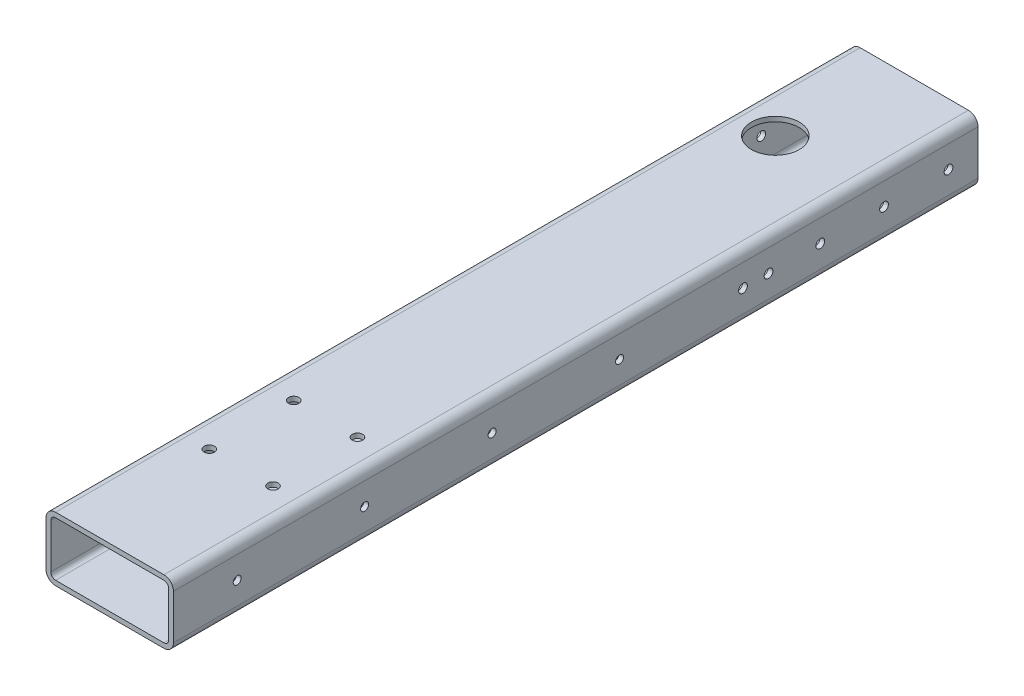
from build123d import *

# Parameters (mm, degrees)
AUFSATZ_LINEAR_AUSTRAGEN1_DEPTH = 505
SKIZZE2_R                       = 3.25
SCHNITT_LINEAR_AUSTRAGEN1_DEPTH = 60
SKIZZE3_R                       = 2.75
SCHNITT_LINEAR_AUSTRAGEN2_DEPTH = 100
SKIZZE4_R                       = 15
SCHNITT_LINEAR_AUSTRAGEN3_DEPTH = 100
SKIZZE5_R                       = 2.5
SCHNITT_LINEAR_AUSTRAGEN4_DEPTH = 100
SKIZZE6_R                       = 3
SCHNITT_LINEAR_AUSTRAGEN5_DEPTH = 10
SKIZZE7_R                       = 20
SCHNITT_LINEAR_AUSTRAGEN6_DEPTH = 5


with BuildPart() as part:
    # Skizze1 → Aufsatz-Linear austragen1 (new body)
    with BuildSketch(Plane.XY):
        with BuildLine():
            Line((-34, 20), (34, 20))
            ThreePointArc((34, 20), (38.242640687, 18.242640687), (40, 14))
            Line((40, 14), (40, -14))
            ThreePointArc((40, -14), (38.242640687, -18.242640687), (34, -20))
            Line((34, -20), (-34, -20))
            ThreePointArc((-34, -20), (-38.242640687, -18.242640687), (-40, -14))
            Line((-40, -14), (-40, 14))
            ThreePointArc((-40, 14), (-38.242640687, 18.242640687), (-34, 20))
        make_face()
        with BuildLine():
            Line((-37, 14), (-37, -14))
            ThreePointArc((-37, -14), (-36.121320344, -16.121320344), (-34, -17))
            Line((-34, -17), (34, -17))
            ThreePointArc((34, -17), (36.121320344, -16.121320344), (37, -14))
            Line((37, -14), (37, 14))
            ThreePointArc((37, 14), (36.121320344, 16.121320344), (34, 17))
            Line((34, 17), (-34, 17))
            ThreePointArc((-34, 17), (-36.121320344, 16.121320344), (-37, 14))
        make_face(mode=Mode.SUBTRACT)
    extrude(amount=AUFSATZ_LINEAR_AUSTRAGEN1_DEPTH)

    # Skizze2 → Schnitt-Linear austragen1 (cut)
    with BuildSketch(Plane(origin=(0, 20, 0), x_dir=(1, 0, 0), z_dir=(0, 1, 0))):
        with Locations(Location((20, -369.5, 0), (0, 0, 270))):
            Circle(SKIZZE2_R)
        with Locations(Location((20, -422.5, 0), (0, 0, 270))):
            Circle(SKIZZE2_R)
        with Locations(Location((-20, -422.5, 0), (0, 0, 90))):
            Circle(SKIZZE2_R)
        with Locations(Location((-20, -369.5, 0), (0, 0, 90))):
            Circle(SKIZZE2_R)
    extrude(amount=-SCHNITT_LINEAR_AUSTRAGEN1_DEPTH, mode=Mode.SUBTRACT)

    # Skizze3 → Schnitt-Linear austragen2 (cut)
    with BuildSketch(Plane(origin=(40, 0, 0), x_dir=(0, 0, -1), z_dir=(1, 0, 0))):
        with Locations((-18.5, 0)):
            Circle(SKIZZE3_R)
        with Locations((-59, 0)):
            Circle(SKIZZE3_R)
        with Locations((-99, 0)):
            Circle(SKIZZE3_R)
        with Locations((-131.5, 0)):
            Circle(SKIZZE3_R)
        with Locations((-147.5, 0)):
            Circle(SKIZZE3_R)
    extrude(amount=-SCHNITT_LINEAR_AUSTRAGEN2_DEPTH, mode=Mode.SUBTRACT)

    # Skizze4 → Schnitt-Linear austragen3 (cut)
    with BuildSketch(Plane.XZ.offset(20)):
        with Locations(Location((-12.7, 74.5, 0), (0, 0, 270))):
            Circle(SKIZZE4_R)
    extrude(amount=-SCHNITT_LINEAR_AUSTRAGEN3_DEPTH, mode=Mode.SUBTRACT)

    # Skizze5 → Schnitt-Linear austragen4 (cut)
    with BuildSketch(Plane.ZY.offset(40)):
        with Locations((465, 0)):
            Circle(SKIZZE5_R)
        with Locations((385, 0)):
            Circle(SKIZZE5_R)
        with Locations((305, 0)):
            Circle(SKIZZE5_R)
        with Locations((225, 0)):
            Circle(SKIZZE5_R)
    extrude(amount=-SCHNITT_LINEAR_AUSTRAGEN4_DEPTH, mode=Mode.SUBTRACT)

    # Skizze6 → Schnitt-Linear austragen5 (cut)
    with BuildSketch(Plane.XZ.offset(20)):
        with Locations(Location((-12.7, 41.195270606, 0), (0, 0, 270))):
            Circle(SKIZZE6_R)
        with Locations(Location((20.604729394, 74.5, 0), (0, 0, 270))):
            Circle(SKIZZE6_R)
        with Locations(Location((-12.7, 107.804729394, 0), (0, 0, 270))):
            Circle(SKIZZE6_R)
        with Locations((-46.004729394, 74.5)):
            Circle(SKIZZE6_R)
    extrude(amount=-SCHNITT_LINEAR_AUSTRAGEN5_DEPTH, mode=Mode.SUBTRACT)

    # Skizze7 → Schnitt-Linear austragen6 (cut)
    with BuildSketch(Plane.XZ.offset(20)):
        with Locations(Location((-12.7, 74.5, 0), (0, 0, 270))):
            Circle(SKIZZE7_R)
    extrude(amount=-SCHNITT_LINEAR_AUSTRAGEN6_DEPTH, mode=Mode.SUBTRACT)


solid = part.part
